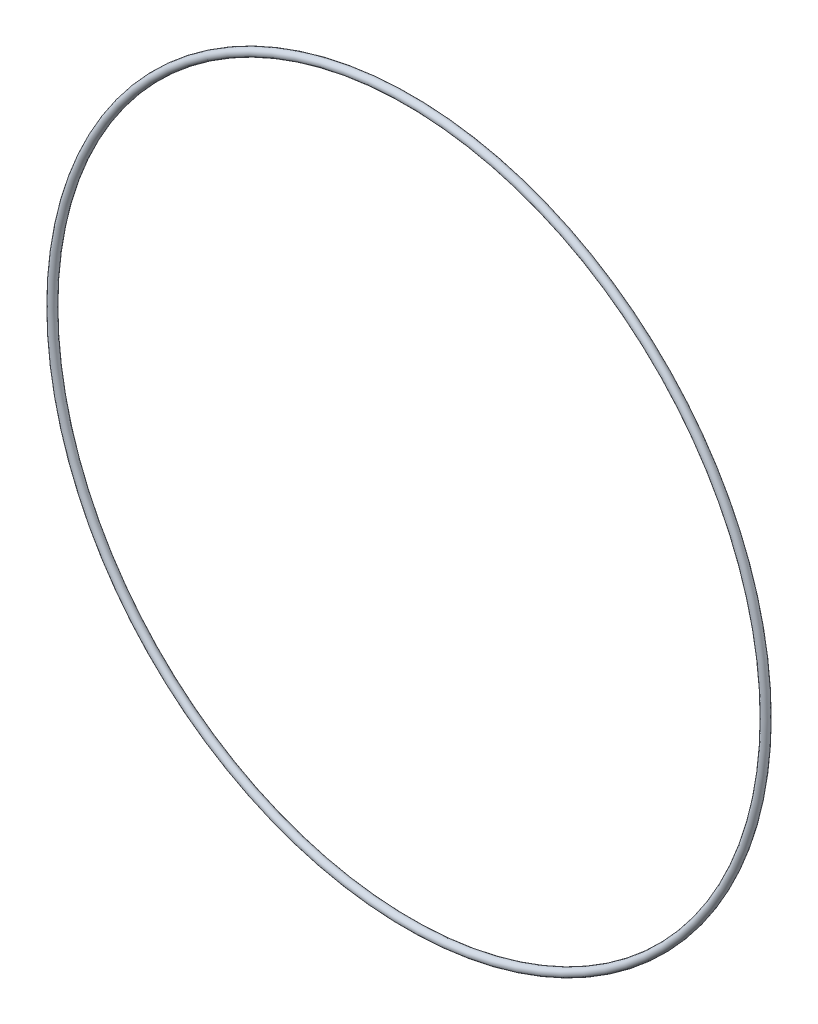
from build123d import *

# Parameters (mm, degrees)
SKETCH1_R = 1.3081


with BuildPart() as part:
    # Sketch1 → Revolve1 (revolve)
    with BuildSketch(Plane(origin=(0, 0, 0), x_dir=(0, -1, 0), z_dir=(1, 0, 0)), mode=Mode.PRIVATE) as revolve1_sk:
        with Locations((118.618, 0)):
            Circle(SKETCH1_R)
    revolve(revolve1_sk.sketch.rotate(Axis((0, 0, 1.3081), (0, 0, -1)), 270), axis=Axis((0, 0, 1.3081), (0, 0, -1)))


solid = part.part
